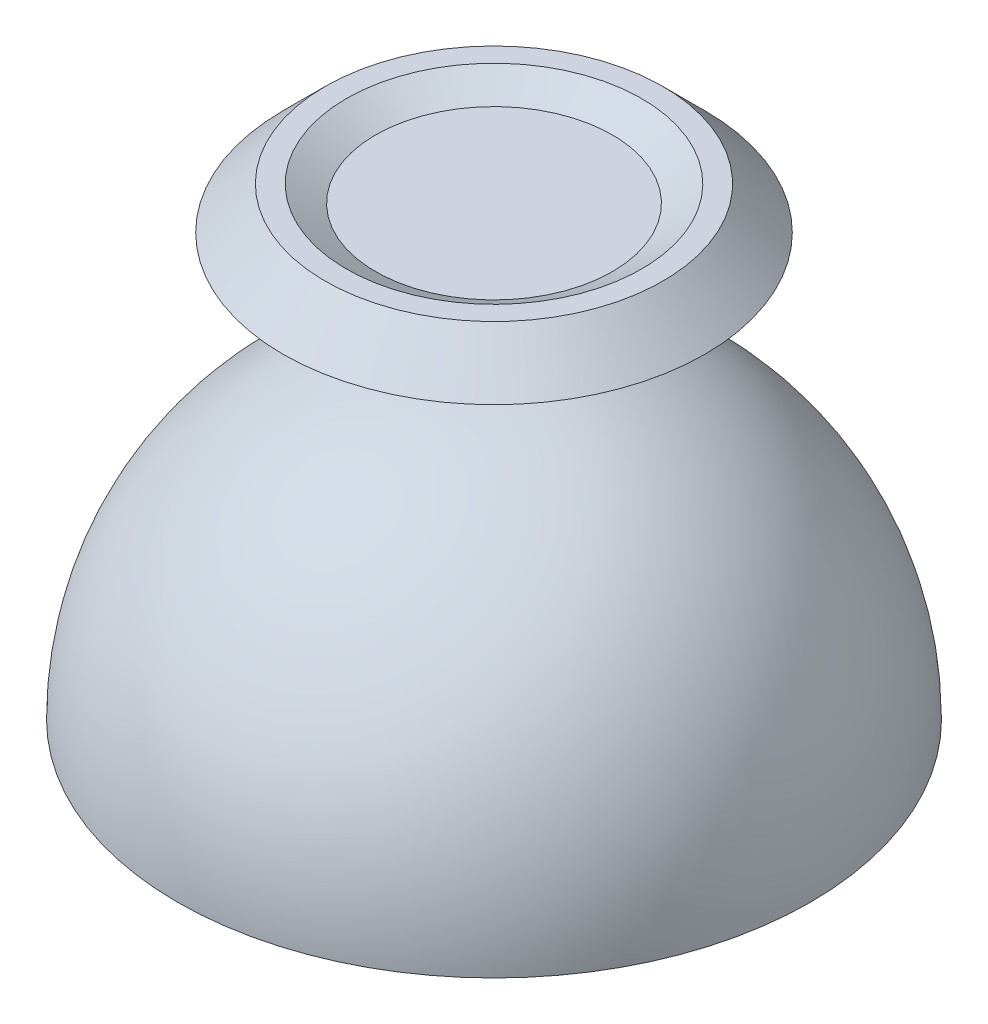
from build123d import *

# Parameters (mm, degrees)
REVOLVE2_ANGLE                       = 180
BOSS_EXTRUDE4_REACH                  = 31.155
BOSS_EXTRUDE4_END_RADIUS             = 15
SKETCH6_R                            = 2.25
SKETCH7_R                            = 10
BOSS_EXTRUDE6_DEPTH                  = 2
BOSS_EXTRUDE6_TAPER                  = 45
SKETCH8_R                            = 7
CUT_EXTRUDE1_DEPTH                   = 0.8
CUT_EXTRUDE1_DRAFT                   = -60
SKETCH3_W                            = 2.2
SKETCH3_H                            = 1.5
CUT_EXTRUDE4_DEPTH                   = 8
BOSS_EXTRUDE7_REACH                  = 28.571
BOSS_EXTRUDE7_END_RADIUS             = 14
SKETCH10_R                           = 2.25
SKETCH10_W                           = 2.2
SKETCH10_H                           = 1.5
BOSS_EXTRUDE9_REACH                  = 33.726
BOSS_EXTRUDE9_END_RADIUS             = 14
SKETCH12_W                           = 0.734734754
SKETCH12_H                           = 3.5
BOSS_EXTRUDE9_DIRECTION_2_REACH      = 33.726
BOSS_EXTRUDE9_DIRECTION_2_END_RADIUS = 2.25
CIRPATTERN1_COUNT                    = 6


with BuildPart() as part:
    # Sketch1 → Revolve2 (revolve)
    with BuildSketch(Plane(origin=(0, 0, 0), x_dir=(1, 0, 0), z_dir=(0, 1, 0))):
        with BuildLine():
            Line((0, -14), (0, -15))
            ThreePointArc((0, -15), (-15, 0), (0, 15))
            Line((0, 15), (0, 14))
            ThreePointArc((0, 14), (-14, 0), (0, -14))
        make_face()
    revolve(axis=Axis((0, 0, -14), (0, 0, -1)), revolution_arc=REVOLVE2_ANGLE)

    # Boss-Extrude4: up to this sphere (the profile starts outside it)
    boss_extrude4_end = Location((0, 0, 0)) * Sphere(BOSS_EXTRUDE4_END_RADIUS, mode=Mode.PRIVATE)
    # Sketch6 → Boss-Extrude4 (add, up to the surface)
    with BuildSketch(Plane(origin=(0, 20, 0), x_dir=(1, 0, 0), z_dir=(0, 1, 0)), mode=Mode.PRIVATE) as boss_extrude4_sk1:
        with Locations(Location((0, 0, 0), (0, 0, 180))):
            Circle(SKETCH6_R)
    boss_extrude4_tool1 = extrude(boss_extrude4_sk1.sketch, amount=-BOSS_EXTRUDE4_REACH, mode=Mode.PRIVATE) - boss_extrude4_end
    add(boss_extrude4_tool1.solids().sort_by_distance((0, 20, 0))[0])

    # Sketch7 → Boss-Extrude6 (add)
    with BuildSketch(Plane(origin=(0, 20, 0), x_dir=(1, 0, 0), z_dir=(0, 1, 0))):
        Circle(SKETCH7_R)
    extrude(amount=BOSS_EXTRUDE6_DEPTH, taper=BOSS_EXTRUDE6_TAPER)


with BuildPart() as cut_extrude1_tool:
    # Sketch8 → Cut-Extrude1 (with draft: the straight prism first)
    with BuildSketch(Plane(origin=(0, 22, 0), x_dir=(1, 0, 0), z_dir=(0, 1, 0))):
        Circle(SKETCH8_R)
    extrude(amount=-CUT_EXTRUDE1_DEPTH)
    # Cut-Extrude1: the draft: its side faces are tilted about the plane it starts from
    cut_extrude1_sides = [cut_extrude1_tool.faces().sort_by_distance(p)[0] for p in [
        (-7, 21.6, 0),
    ]]
    draft(cut_extrude1_sides, Plane(origin=(0, 22, 0), x_dir=(1, 0, 0), z_dir=(0, 1, 0)), CUT_EXTRUDE1_DRAFT)


with BuildPart() as part_1:
    add(part.part)

    # Cut-Extrude1: cut by cut_extrude1_tool
    add(cut_extrude1_tool.part, mode=Mode.SUBTRACT)

    # Sketch3 → Cut-Extrude4 (cut)
    with BuildSketch(Plane(origin=(0, 6, 0), x_dir=(-1, 0, 0), z_dir=(0, -1, 0))):
        Rectangle(SKETCH3_W, SKETCH3_H)
    extrude(amount=-CUT_EXTRUDE4_DEPTH, mode=Mode.SUBTRACT)

    # Boss-Extrude7: up to this sphere (the profile starts inside it)
    boss_extrude7_end = Location((0, 0, 0)) * Sphere(BOSS_EXTRUDE7_END_RADIUS, mode=Mode.PRIVATE)
    # Sketch10 → Boss-Extrude7 (add, up to the surface)
    with BuildSketch(Plane(origin=(0, 6, 0), x_dir=(-1, 0, 0), z_dir=(0, -1, 0)), mode=Mode.PRIVATE) as boss_extrude7_sk1:
        Circle(SKETCH10_R)
        Rectangle(SKETCH10_W, SKETCH10_H, mode=Mode.SUBTRACT)
    boss_extrude7_tool1 = extrude(boss_extrude7_sk1.sketch, amount=-BOSS_EXTRUDE7_REACH, mode=Mode.PRIVATE) & boss_extrude7_end
    add(boss_extrude7_tool1.solids().sort_by_distance((2.18636, 6, 0))[0])

    # Boss-Extrude9: up to this sphere (the profile starts inside it)
    boss_extrude9_end = Location((0, 0, 0)) * Sphere(BOSS_EXTRUDE9_END_RADIUS, mode=Mode.PRIVATE)
    # Sketch12 → Boss-Extrude9 (add, up to the surface)
    with BuildSketch(Plane.ZY.offset(2.25), mode=Mode.PRIVATE) as boss_extrude9_sk1:
        with Locations((0, 12.057093613)):
            Rectangle(SKETCH12_W, SKETCH12_H)
    boss_extrude9_tool1 = extrude(boss_extrude9_sk1.sketch, amount=BOSS_EXTRUDE9_REACH, mode=Mode.PRIVATE) & boss_extrude9_end
    boss_extrude9 = boss_extrude9_tool1.solids().sort_by_distance((-2.25, 12.057094, 0))[0]
    add(boss_extrude9)

    # Boss-Extrude9 direction 2: up to this cylinder (the profile starts outside it)
    boss_extrude9_direction_2_end = Plane(origin=(0, 12.057094, 0), z_dir=(0, -1, 0)) * Cylinder(BOSS_EXTRUDE9_DIRECTION_2_END_RADIUS, 72.952, mode=Mode.PRIVATE)
    # Sketch12 → Boss-Extrude9 direction 2 (add, up to the surface)
    with BuildSketch(Plane.ZY.offset(2.25), mode=Mode.PRIVATE) as boss_extrude9_direction_2_sk1:
        with Locations((0, 12.057093613)):
            Rectangle(SKETCH12_W, SKETCH12_H)
    boss_extrude9_direction_2_tool1 = extrude(boss_extrude9_direction_2_sk1.sketch, amount=-BOSS_EXTRUDE9_DIRECTION_2_REACH, mode=Mode.PRIVATE) - boss_extrude9_direction_2_end
    boss_extrude9_direction_2 = boss_extrude9_direction_2_tool1.solids().sort_by_distance((-2.25, 12.057094, 0))[0] + boss_extrude9_direction_2_tool1.solids().sort_by_distance((-2.25, 12.057094, 0))[1]
    add(boss_extrude9_direction_2)
    boss_extrude9 = boss_extrude9 + boss_extrude9_direction_2  # both directions under the feature's name, for the pattern or mirror that repeats it

    # CirPattern1: Boss-Extrude9 ×6 about axis
    cirpattern1_axis = Axis((0, 0, 0), (0, 1, 0))
    for i in range(1, CIRPATTERN1_COUNT):
        add(boss_extrude9.rotate(cirpattern1_axis, i * 360 / CIRPATTERN1_COUNT))


solid = part_1.part
